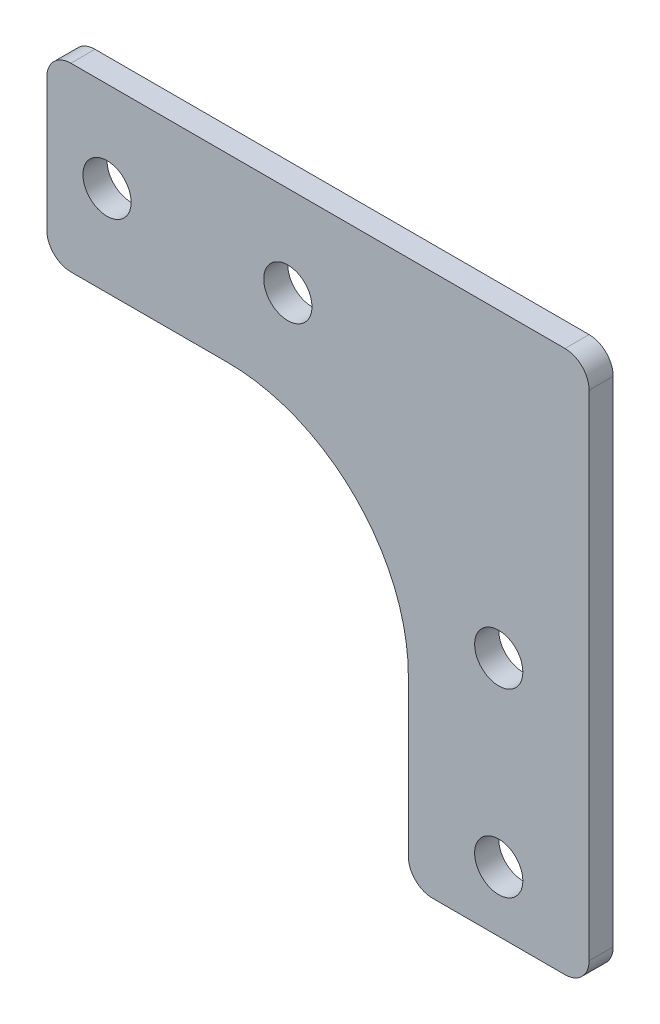
from build123d import *

# Parameters (mm, degrees)
EXTRUDE_1_DEPTH     = 2
SKETCH_2_R          = 2
CUT_EXTRUDE_1_DEPTH = 2
FILLET_1_R          = 2


with BuildPart() as part:
    # 草图1 → 凸台-拉伸1 (new body)
    with BuildSketch(Plane.XY):
        with BuildLine():
            Line((0, 0), (0, -45))
            Line((0, -45), (-15, -45))
            Line((-15, -45), (-15, -30))
            ThreePointArc((-15, -30), (-19.393398282, -19.393398282), (-30, -15))
            Line((-30, -15), (-45, -15))
            Line((-45, -15), (-45, 0))
            Line((-45, 0), (0, 0))
        make_face()
    extrude(amount=EXTRUDE_1_DEPTH)

    # 草图2 → 切除-拉伸1 (cut)
    with BuildSketch(Plane.XY.offset(2)):
        with Locations((-7.5, -40)):
            Circle(SKETCH_2_R)
        with Locations((-7.5, -25)):
            Circle(SKETCH_2_R)
        with Locations((-25, -7.5)):
            Circle(SKETCH_2_R)
        with Locations((-40, -7.5)):
            Circle(SKETCH_2_R)
    extrude(amount=-CUT_EXTRUDE_1_DEPTH, mode=Mode.SUBTRACT)

    # 圆角1
    fillet_1_edges = [part.edges().sort_by_distance(p)[0] for p in [
        (0, 0, 1),
        (0, -45, 1),
        (-15, -45, 1),
        (-45, -15, 1),
        (-45, 0, 1),
    ]]
    fillet(fillet_1_edges, radius=FILLET_1_R)


solid = part.part
